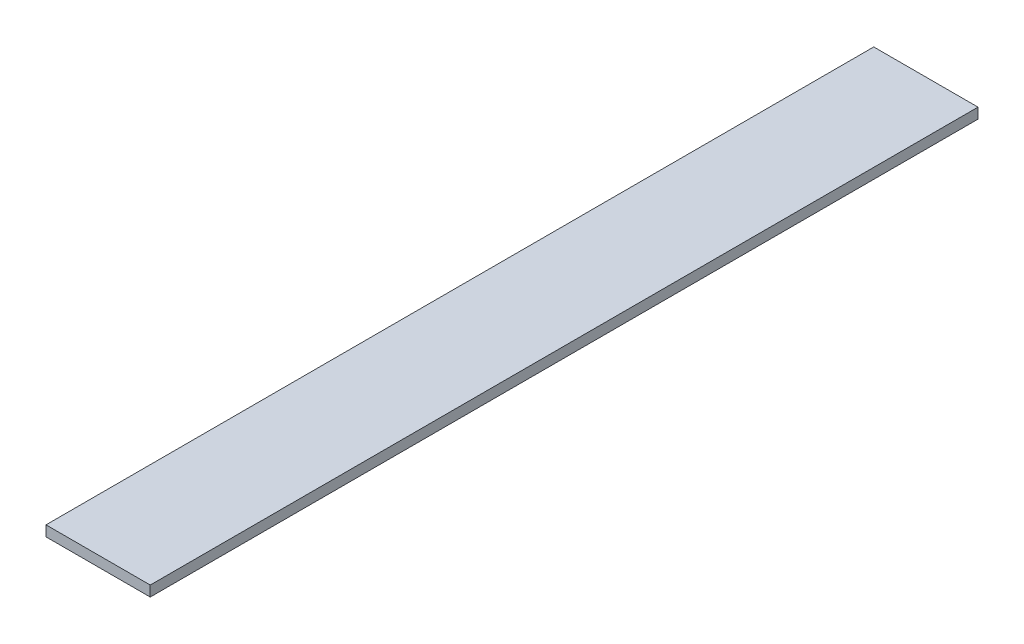
from build123d import *

# Parameters (mm, degrees)
SKETCH1_W               = 930
SKETCH1_H               = 555
SKETCH1_W_2             = 803
SKETCH1_H_2             = 504.2
BOSS_EXTRUDE2_DEPTH     = 6.35
CUT_EXTRUDE1_DEPTH      = 542.54554056
CUT_EXTRUDE1_DEPTH_BACK = 542.54554056


with BuildPart() as part:
    # Sketch1 → Boss-Extrude2 (new body)
    with BuildSketch(Plane(origin=(0, 0, 0), x_dir=(1, 0, 0), z_dir=(0, 1, 0))):
        Rectangle(SKETCH1_W, SKETCH1_H)
        Rectangle(SKETCH1_W_2, SKETCH1_H_2, mode=Mode.SUBTRACT)
    extrude(amount=BOSS_EXTRUDE2_DEPTH)

    # Sketch2 → Cut-Extrude1 (cut, two sides: drawn at the far end of the back side and taken through both)
    with BuildSketch(Plane(origin=(0, 6.35, 0), x_dir=(1, 0, 0), z_dir=(0, 1, 0)).offset(-CUT_EXTRUDE1_DEPTH_BACK)):
        Polygon((-465, 277.5), (426.9, 277.5), (465, 277.5), (465, -277.5), (426.9, -277.5), (-465, -277.5), (-465, -252.1), (401.5, -252.1), (401.5, 252.1), (-465, 252.1), align=None)
    extrude(amount=CUT_EXTRUDE1_DEPTH + CUT_EXTRUDE1_DEPTH_BACK, mode=Mode.SUBTRACT)


solid = part.part
